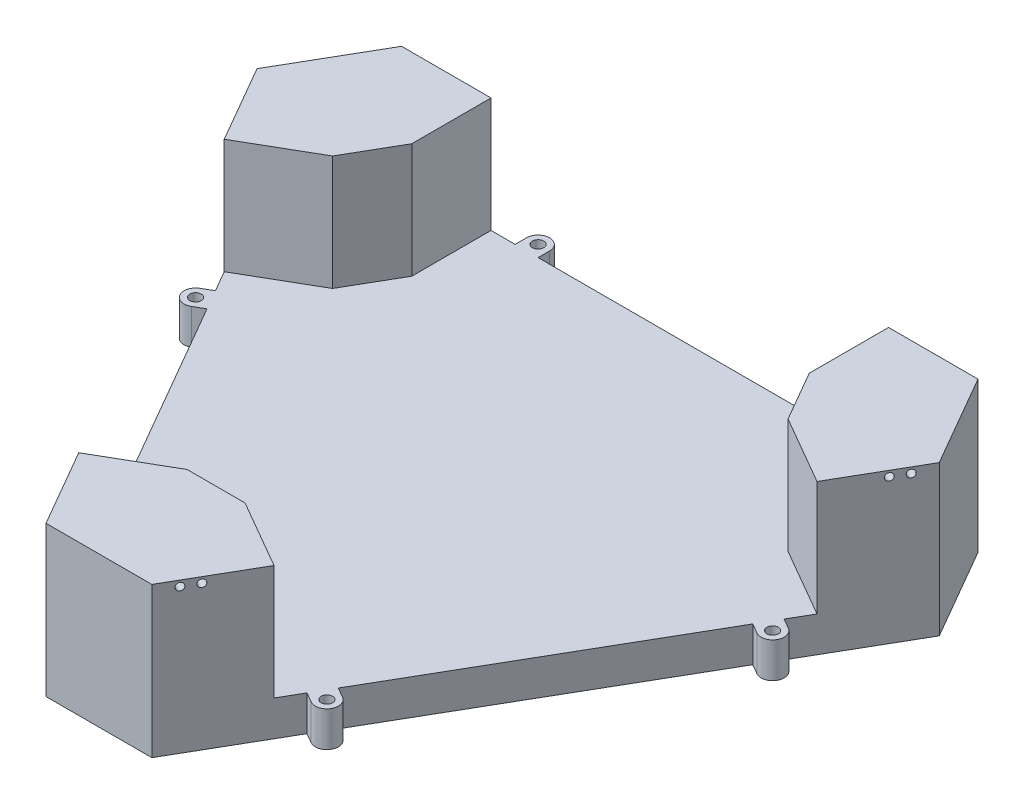
from build123d import *

# Parameters (mm, degrees)
BOSS_EXTRUDE2_DEPTH = 5.4
BOSS_EXTRUDE3_DEPTH = 60
SKETCH28_R          = 1.6
CUT_EXTRUDE3_DEPTH  = 8.2
SKETCH29_R          = 1.6
CUT_EXTRUDE4_DEPTH  = 8.2
SKETCH30_R          = 1.6
CUT_EXTRUDE5_DEPTH  = 8.2
SKETCH31_R          = 1.6
CUT_EXTRUDE6_DEPTH  = 8.2
CUT_EXTRUDE7_DEPTH  = 50
SKETCH33_R          = 2.5
BOSS_EXTRUDE4_DEPTH = 15.4


with BuildPart() as part:
    # Sketch1 → Boss-Extrude2 (new body)
    with BuildSketch(Plane(origin=(0, 0, 0), x_dir=(1, 0, 0), z_dir=(0, 1, 0))):
        Polygon((-266.076640718, -7.104357828), (-272.301088237, 3.676701524), (-249.238844193, 43.621679945), (-236.789949155, 43.621679945), (-10.515779175, 43.621679945), (1.933115864, 43.621679945), (24.995359908, 3.676701524), (18.770912388, -7.104357828), (-94.366172601, -203.063537251), (-100.590620121, -213.844596604), (-146.715108209, -213.844596604), (-152.939555728, -203.063537251), align=None)
    extrude(amount=BOSS_EXTRUDE2_DEPTH)

    # Sketch25 → Boss-Extrude3 (add)
    with BuildSketch(Plane.XZ):
        Polygon((-272.301088237, -3.676701524), (-249.238844193, -43.621679945), (1.933115864, -43.621679945), (24.995359908, -3.676701524), (-100.590620121, 213.844596604), (-146.715108209, 213.844596604), align=None)
    extrude(amount=BOSS_EXTRUDE3_DEPTH)

    # Sketch28 → Cut-Extrude3 (cut)
    with BuildSketch(Plane(origin=(-202.633757717, 0, 116.990654565), x_dir=(0.499999999999994, 0, 0.8660254037844421), z_dir=(-0.8660254037844421, 0, 0.499999999999994))):
        with Locations((95.888403978, 2.9)):
            Circle(SKETCH28_R)
        with Locations((102.888403978, 2.9)):
            Circle(SKETCH28_R)
    extrude(amount=-CUT_EXTRUDE3_DEPTH, mode=Mode.SUBTRACT)

    # Sketch29 → Cut-Extrude4 (cut)
    with BuildSketch(Plane(origin=(-202.633757717, 0, 116.990654565), x_dir=(0.499999999999994, 0, 0.8660254037844421), z_dir=(-0.8660254037844421, 0, 0.499999999999994))):
        with Locations((-130.385766002, 2.9)):
            Circle(SKETCH29_R)
        with Locations((-123.385766002, 2.9)):
            Circle(SKETCH29_R)
    extrude(amount=-CUT_EXTRUDE4_DEPTH, mode=Mode.SUBTRACT)

    # Sketch30 → Cut-Extrude5 (cut)
    with BuildSketch(Plane(origin=(0, 0, -43.621679945), x_dir=(-1, 0, 0), z_dir=(0, 0, -1))):
        with Locations((233.289949155, 2.9)):
            Circle(SKETCH30_R)
        with Locations((240.289949155, 2.9)):
            Circle(SKETCH30_R)
        with Locations((7.015779175, 2.9)):
            Circle(SKETCH30_R)
        with Locations((14.015779175, 2.9)):
            Circle(SKETCH30_R)
    extrude(amount=-CUT_EXTRUDE5_DEPTH, mode=Mode.SUBTRACT)

    # Sketch31 → Cut-Extrude6 (cut)
    with BuildSketch(Plane(origin=(17.15446147, 0, 9.904132947), x_dir=(0.49999999999999983, 0, -0.8660254037844387), z_dir=(0.8660254037844387, 0, 0.49999999999999983))):
        with Locations((-0.267098163, 2.9)):
            Circle(SKETCH31_R)
        with Locations((6.732901837, 2.9)):
            Circle(SKETCH31_R)
        with Locations((-226.541268142, 2.9)):
            Circle(SKETCH31_R)
        with Locations((-219.541268142, 2.9)):
            Circle(SKETCH31_R)
    extrude(amount=-CUT_EXTRUDE6_DEPTH, mode=Mode.SUBTRACT)

    # Sketch32 → Cut-Extrude7 (cut)
    with BuildSketch(Plane(origin=(0, 5.4, 0), x_dir=(1, 0, 0), z_dir=(0, 1, 0))):
        Polygon((-252.809368412, -30.08394754), (-222.888866427, -12.809337664), (-210.255404543, 9.072460194), (-210.255404543, 43.621679945), (-37.050323786, 43.621679945), (-37.050323786, 9.072460194), (-24.416861903, -12.809337664), (5.503640083, -30.08394754), (-81.098900296, -180.08394754), (-111.019402281, -162.809337664), (-136.286326048, -162.809337664), (-166.206828034, -180.08394754), align=None)
    extrude(amount=-CUT_EXTRUDE7_DEPTH, mode=Mode.SUBTRACT)

    # Sketch33 → Boss-Extrude4 (add)
    # profile 1 of 6: a face of its own
    with BuildSketch(Plane(origin=(0, -44.6, 0), x_dir=(1, 0, 0), z_dir=(0, 1, 0))):
        with BuildLine():
            Line((-57.550882031, 43.621679945), (-47.550882031, 43.621679945))
            Line((-47.550882031, 43.621679945), (-47.550882031, 48.621679945))
            ThreePointArc((-47.550882031, 48.621679945), (-52.550882031, 53.621679945), (-57.550882031, 48.621679945))
            Line((-57.550882031, 48.621679945), (-57.550882031, 43.621679945))
        make_face()
        with Locations(Location((-52.550882031, 48.621679945, 0), (0, 0, 270))):
            Circle(SKETCH33_R, mode=Mode.SUBTRACT)
    # profile 2 of 6: a face of its own
    with BuildSketch(Plane(origin=(0, -44.6, 0), x_dir=(1, 0, 0), z_dir=(0, 1, 0))):
        with BuildLine():
            Line((-189.754846299, 43.621679945), (-189.754846299, 48.621679945))
            ThreePointArc((-189.754846299, 48.621679945), (-194.754846299, 53.621679945), (-199.754846299, 48.621679945))
            Line((-199.754846299, 48.621679945), (-199.754846299, 43.621679945))
            Line((-199.754846299, 43.621679945), (-189.754846299, 43.621679945))
        make_face()
        with Locations(Location((-194.754846299, 48.621679945, 0), (0, 0, 90))):
            Circle(SKETCH33_R, mode=Mode.SUBTRACT)
    # profile 3 of 6: a face of its own
    with BuildSketch(Plane(origin=(0, -44.6, 0), x_dir=(1, 0, 0), z_dir=(0, 1, 0))):
        with BuildLine():
            Line((-242.55908929, -47.837951771), (-247.55908929, -39.177697733))
            Line((-247.55908929, -39.177697733), (-251.889216309, -41.677697733))
            ThreePointArc((-251.889216309, -41.677697733), (-253.719343328, -48.507824752), (-246.889216309, -50.337951771))
            Line((-246.889216309, -50.337951771), (-242.55908929, -47.837951771))
        make_face()
        with Locations(Location((-249.389216309, -46.007824752, 0), (0, 0, 270))):
            Circle(SKETCH33_R, mode=Mode.SUBTRACT)
    # profile 4 of 6: a face of its own
    with BuildSketch(Plane(origin=(0, -44.6, 0), x_dir=(1, 0, 0), z_dir=(0, 1, 0))):
        with BuildLine():
            Line((-176.457107156, -162.329943308), (-180.787234175, -164.829943308))
            ThreePointArc((-180.787234175, -164.829943308), (-182.617361194, -171.660070327), (-175.787234175, -173.490197346))
            Line((-175.787234175, -173.490197346), (-171.457107156, -170.990197346))
            Line((-171.457107156, -170.990197346), (-176.457107156, -162.329943308))
        make_face()
        with Locations(Location((-178.287234175, -169.160070327, 0), (0, 0, 90))):
            Circle(SKETCH33_R, mode=Mode.SUBTRACT)
    # profile 5 of 6: a face of its own
    with BuildSketch(Plane(origin=(0, -44.6, 0), x_dir=(1, 0, 0), z_dir=(0, 1, 0))):
        with BuildLine():
            Line((-70.848621174, -162.329943308), (-75.848621174, -170.990197346))
            Line((-75.848621174, -170.990197346), (-71.518494155, -173.490197346))
            ThreePointArc((-71.518494155, -173.490197346), (-64.688367136, -171.660070327), (-66.518494155, -164.829943308))
            Line((-66.518494155, -164.829943308), (-70.848621174, -162.329943308))
        make_face()
        with Locations(Location((-69.018494155, -169.160070327, 0), (0, 0, 270))):
            Circle(SKETCH33_R, mode=Mode.SUBTRACT)
    # profile 6 of 6: a face of its own
    with BuildSketch(Plane(origin=(0, -44.6, 0), x_dir=(1, 0, 0), z_dir=(0, 1, 0))):
        with BuildLine():
            Line((-4.74663904, -47.837951771), (-0.416512021, -50.337951771))
            ThreePointArc((-0.416512021, -50.337951771), (6.413614998, -48.507824752), (4.583487979, -41.677697733))
            Line((4.583487979, -41.677697733), (0.25336096, -39.177697733))
            Line((0.25336096, -39.177697733), (-4.74663904, -47.837951771))
        make_face()
        with Locations(Location((2.083487979, -46.007824752, 0), (0, 0, 90))):
            Circle(SKETCH33_R, mode=Mode.SUBTRACT)
    extrude(amount=-BOSS_EXTRUDE4_DEPTH)


solid = part.part
